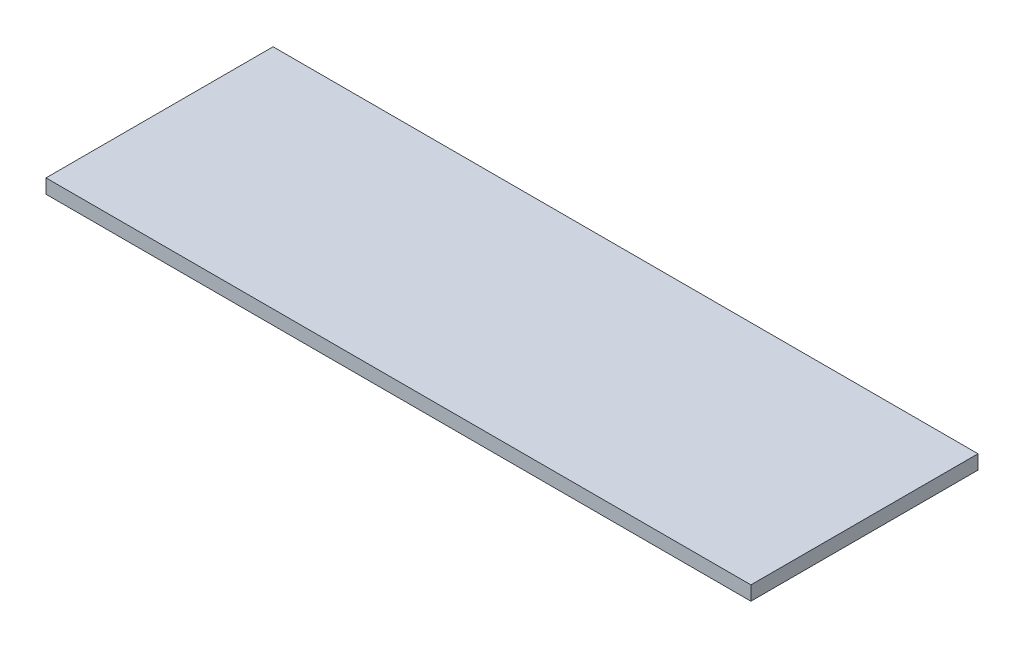
from build123d import *

# Parameters (mm, degrees)
SKETCH1_W           = 149
SKETCH1_H           = 48
BOSS_EXTRUDE1_DEPTH = 3


with BuildPart() as part:
    # Sketch1 → Boss-Extrude1 (new body)
    with BuildSketch(Plane(origin=(0, 0, 0), x_dir=(1, 0, 0), z_dir=(0, 1, 0))):
        Rectangle(SKETCH1_W, SKETCH1_H)
    extrude(amount=BOSS_EXTRUDE1_DEPTH)


solid = part.part
